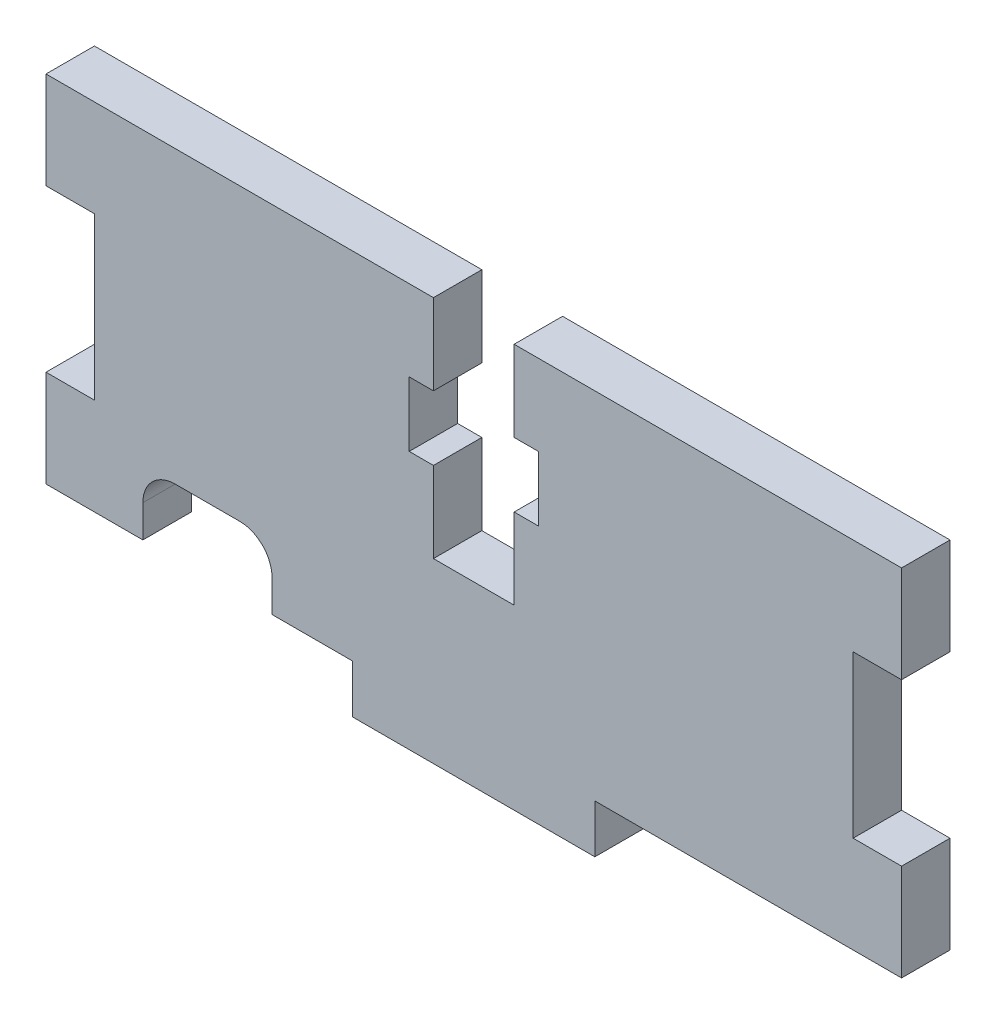
from build123d import *

# Parameters (mm, degrees)
BOSS_EXTRUDE1_DEPTH = 1.5
SKETCH2_W           = 3
SKETCH2_H           = 10
CUT_EXTRUDE1_DEPTH  = 56.865910894
SKETCH3_W           = 55
SKETCH3_H           = 25
CUT_EXTRUDE2_DEPTH  = 56.865910894
CUT_EXTRUDE3_DEPTH  = 56.865910894
CUT_EXTRUDE4_DEPTH  = 56.865910894


with BuildPart() as part:
    # Sketch1 → Boss-Extrude1 (new, symmetric)
    with BuildSketch(Plane.XY):
        Polygon((-20, -11), (20, -11), (20, -14), (35, -14), (35, -11), (54, -11), (54, 11), (-54, 11), (-54, -11), (-35, -11), (-35, -14), (-20, -14), align=None)
    extrude(amount=BOSS_EXTRUDE1_DEPTH, both=True)

    # Sketch2 → Cut-Extrude1 (cut, through all)
    with BuildSketch(Plane.XY.offset(1.5)):
        with Locations((2.5, 0)):
            Rectangle(SKETCH2_W, SKETCH2_H)
        with Locations((52.5, 0)):
            Rectangle(SKETCH2_W, SKETCH2_H)
    extrude(amount=-CUT_EXTRUDE1_DEPTH, mode=Mode.SUBTRACT)

    # Sketch3 → Cut-Extrude2 (cut, through all)
    with BuildSketch(Plane.XY.offset(1.5)):
        with Locations((-26.5, -1.5)):
            Rectangle(SKETCH3_W, SKETCH3_H)
    extrude(amount=-CUT_EXTRUDE2_DEPTH, mode=Mode.SUBTRACT)

    # Sketch4 → Cut-Extrude3 (cut, through all)
    with BuildSketch(Plane(origin=(0, 0, -1.5), x_dir=(-1, 0, 0), z_dir=(0, 0, -1))):
        with BuildLine():
            Line((-7, -11), (-7, -9))
            ThreePointArc((-7, -9), (-7.585786438, -7.585786438), (-9, -7))
            Line((-9, -7), (-13, -7))
            ThreePointArc((-13, -7), (-14.414213562, -7.585786438), (-15, -9))
            Line((-15, -9), (-15, -11))
            Line((-15, -11), (-7, -11))
        make_face()
    extrude(amount=-CUT_EXTRUDE3_DEPTH, mode=Mode.SUBTRACT)

    # Sketch5 → Cut-Extrude4 (cut, through all)
    with BuildSketch(Plane.XY.offset(1.5)):
        Polygon((25, 11), (25, 6), (23.5, 6), (23.5, 2), (25, 2), (25, -3), (30, -3), (30, 2), (31.5, 2), (31.5, 6), (30, 6), (30, 11), align=None)
    extrude(amount=-CUT_EXTRUDE4_DEPTH, mode=Mode.SUBTRACT)


solid = part.part
